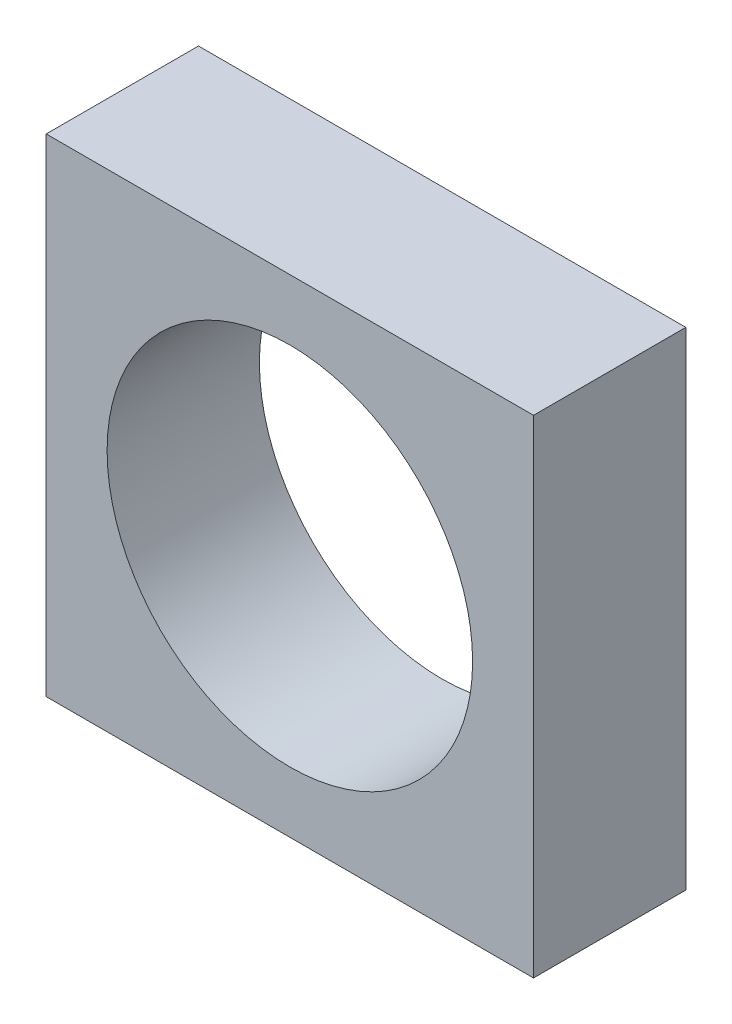
from build123d import *

# Parameters (mm, degrees)
SKETCH_1_W      = 16
SKETCH_1_H      = 16
SKETCH_1_R      = 6
EXTRUDE_1_DEPTH = 5


with BuildPart() as part:
    # 草图1 → 凸台-拉伸1 (new body)
    with BuildSketch(Plane.XY):
        Rectangle(SKETCH_1_W, SKETCH_1_H)
        Circle(SKETCH_1_R, mode=Mode.SUBTRACT)
    extrude(amount=EXTRUDE_1_DEPTH)


solid = part.part
